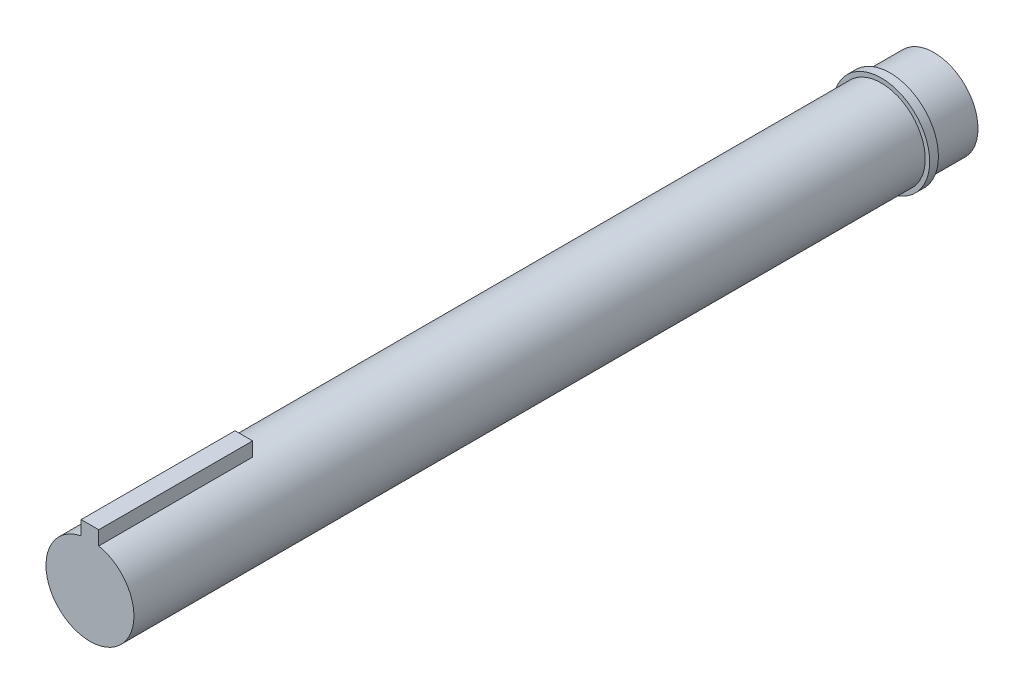
from build123d import *

# Parameters (mm, degrees)
SKETCH1_R           = 12.7
BOSS_EXTRUDE1_DEPTH = 12.7
SKETCH2_R           = 13.97
BOSS_EXTRUDE2_DEPTH = 2.54
SKETCH3_R           = 12.7
BOSS_EXTRUDE3_DEPTH = 228.6
BOSS_EXTRUDE4_START = -44.45
BOSS_EXTRUDE4_DEPTH = 44.45


with BuildPart() as part:
    # Sketch1 → Boss-Extrude1 (new body)
    with BuildSketch(Plane.XY):
        Circle(SKETCH1_R)
    extrude(amount=BOSS_EXTRUDE1_DEPTH)

    # Sketch2 → Boss-Extrude2 (add)
    with BuildSketch(Plane.XY.offset(12.7)):
        Circle(SKETCH2_R)
    extrude(amount=BOSS_EXTRUDE2_DEPTH)

    # Sketch3 → Boss-Extrude3 (add)
    with BuildSketch(Plane.XY.offset(15.24)):
        Circle(SKETCH3_R)
    extrude(amount=BOSS_EXTRUDE3_DEPTH)

    # Sketch4 → Boss-Extrude4 (add)
    with BuildSketch(Plane.XY.offset(243.84).offset(BOSS_EXTRUDE4_START)):
        with BuildLine():
            Line((-2.54, 16.51), (2.54, 16.51))
            Line((2.54, 16.51), (2.54, 12.443407893))
            ThreePointArc((2.54, 12.443407893), (0, 12.7), (-2.54, 12.443407893))
            Line((-2.54, 12.443407893), (-2.54, 16.51))
        make_face()
    extrude(amount=BOSS_EXTRUDE4_DEPTH)


solid = part.part
